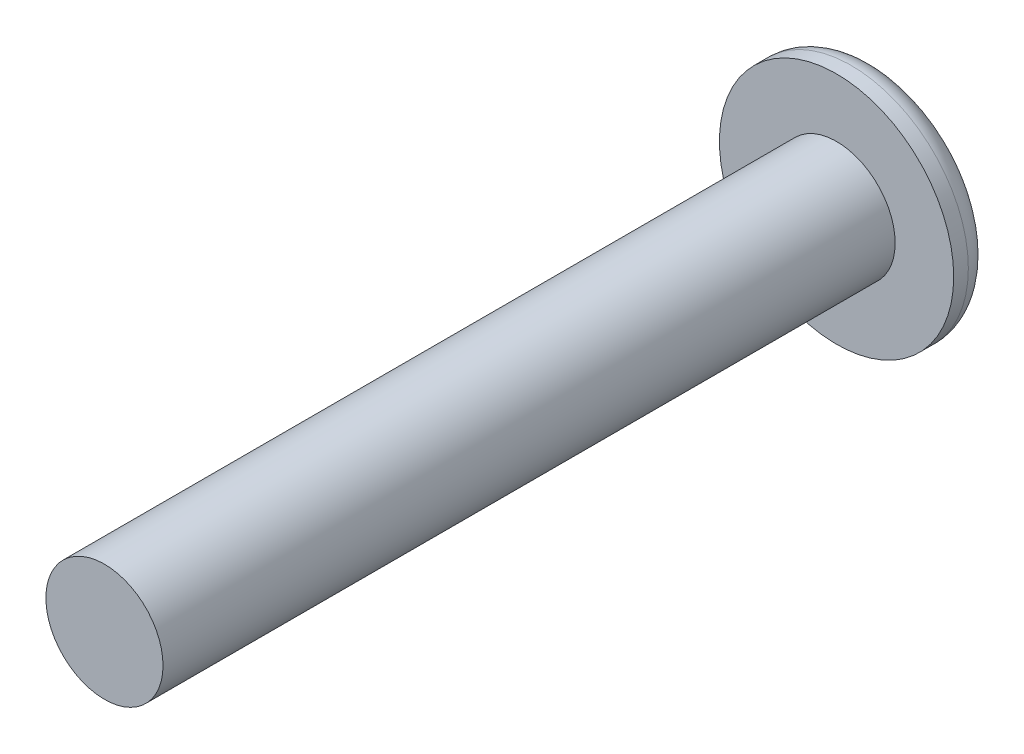
from build123d import *

# Parameters (mm, degrees)
SKETCH_1_R          = 4
EXTRUDE_1_DEPTH     = 1.3
SKETCH_2_R          = 2
EXTRUDE_2_DEPTH     = 25
CUT_EXTRUDE_1_DEPTH = 1.2
FILLET_1_R          = 0.8


with BuildPart() as part:
    # 草图1 → 凸台-拉伸1 (new body)
    with BuildSketch(Plane.XY):
        Circle(SKETCH_1_R)
    extrude(amount=EXTRUDE_1_DEPTH)

    # 草图2 → 凸台-拉伸2 (add)
    with BuildSketch(Plane.XY.offset(1.3)):
        Circle(SKETCH_2_R)
    extrude(amount=EXTRUDE_2_DEPTH)

    # 草图3 → 切除-拉伸1 (cut)
    with BuildSketch(Plane(origin=(0, 0, 0), x_dir=(-1, 0, 0), z_dir=(0, 0, -1))):
        Polygon((-0.721687836, 1.25), (-1.443375673, 0), (-0.721687836, -1.25), (0.721687836, -1.25), (1.443375673, 0), (0.721687836, 1.25), align=None)
    extrude(amount=-CUT_EXTRUDE_1_DEPTH, mode=Mode.SUBTRACT)

    # 圆角1
    fillet_1_edges = [part.edges().sort_by_distance(p)[0] for p in [
        (-4, 0, 0),
    ]]
    fillet(fillet_1_edges, radius=FILLET_1_R)


solid = part.part
